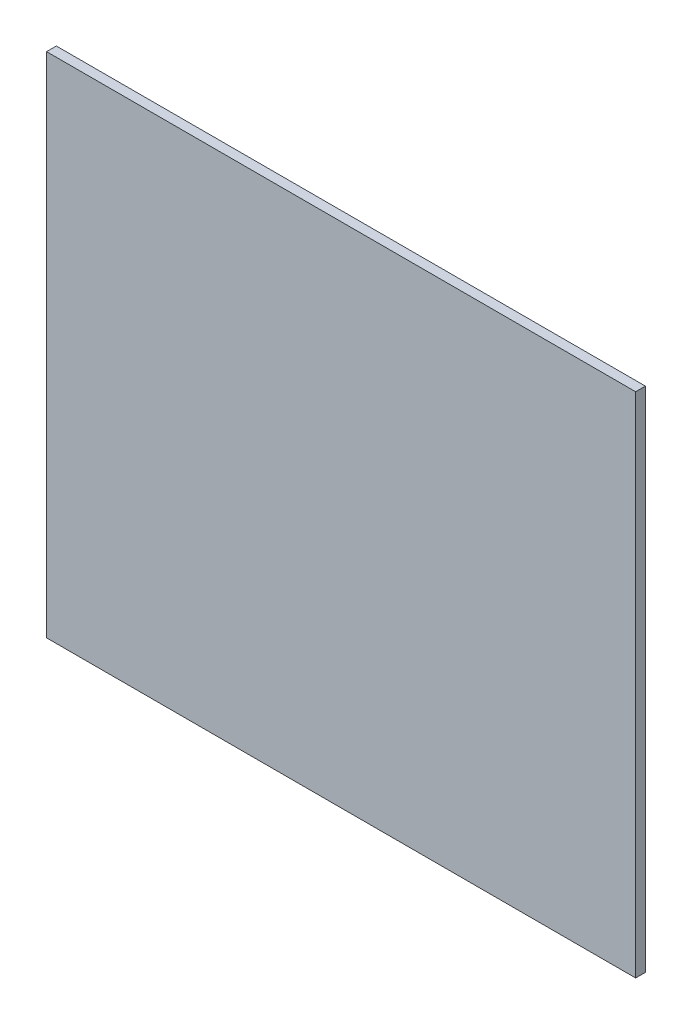
from build123d import *

# Parameters (mm, degrees)
SKETCH1_W           = 181
SKETCH1_H           = 156
BOSS_EXTRUDE1_DEPTH = 3


with BuildPart() as part:
    # Sketch1 → Boss-Extrude1 (new body)
    with BuildSketch(Plane.XY.offset(10)):
        with Locations((77.5, 65)):
            Rectangle(SKETCH1_W, SKETCH1_H)
    extrude(amount=BOSS_EXTRUDE1_DEPTH)


solid = part.part
